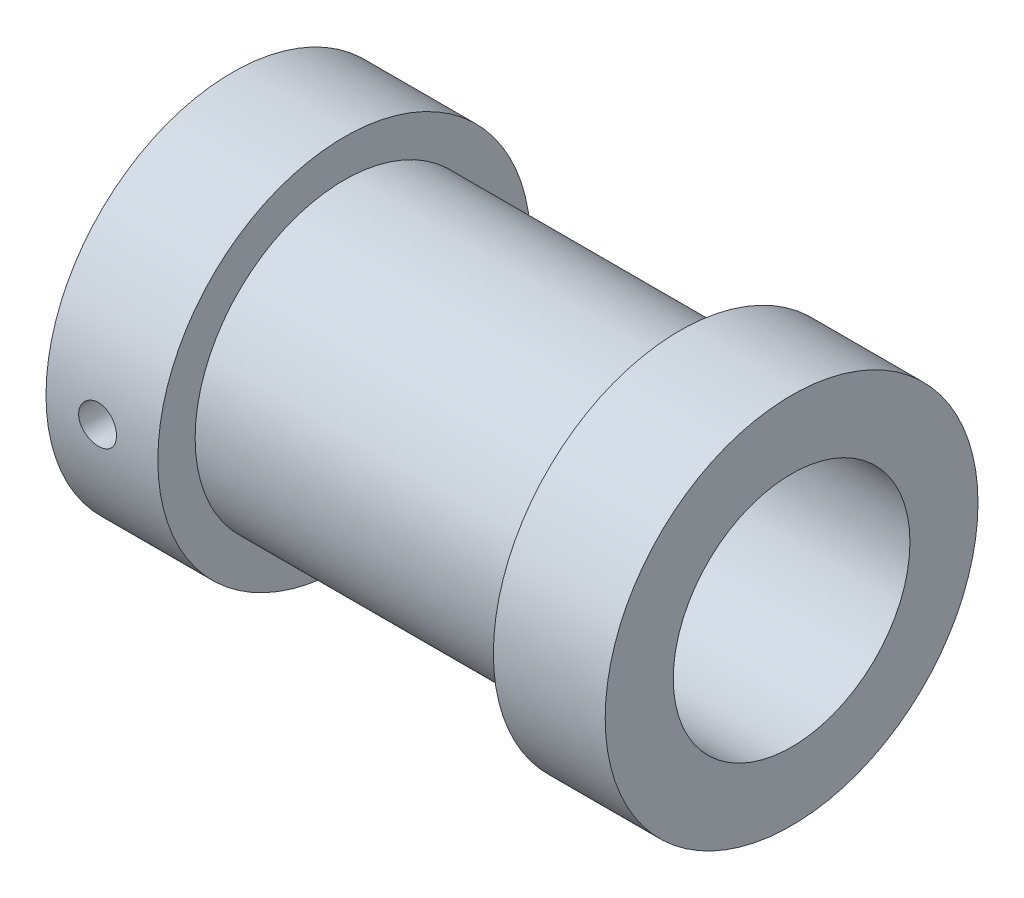
from build123d import *

# Parameters (mm, degrees)
SKETCH1_R           = 5
SKETCH1_R_2         = 3.175
BOSS_EXTRUDE1_DEPTH = 15
SKETCH2_W           = 9
SKETCH2_H           = 1


with BuildPart() as part:
    # Sketch1 → Boss-Extrude1 (new body)
    with BuildSketch(Plane(origin=(0, 0, 0), x_dir=(0, 0, -1), z_dir=(1, 0, 0))):
        Circle(SKETCH1_R)
        Circle(SKETCH1_R_2, mode=Mode.SUBTRACT)
    extrude(amount=BOSS_EXTRUDE1_DEPTH)

    # Sketch2 → Cut-Revolve1 (revolve, cut)
    with BuildSketch(Plane.XY, mode=Mode.PRIVATE) as cut_revolve1_sk:
        with Locations((7.5, 4.5)):
            Rectangle(SKETCH2_W, SKETCH2_H)
    revolve(cut_revolve1_sk.sketch.rotate(Axis((15, 0, 0), (-1, 0, 0)), 90), axis=Axis((15, 0, 0), (-1, 0, 0)), mode=Mode.SUBTRACT)

    # Sketch3 → #60 (0.04) Diameter Hole1 (revolve, cut)
    with BuildSketch(Plane.YZ.offset(1.382942836)):
        Polygon((0, 0), (0, 25.705237194), (0.508, 25.4), (0.508, 0), align=None)
    revolve(axis=Axis((1.382942836, 0, -6.35), (0, 0, 1)), mode=Mode.SUBTRACT)


solid = part.part
